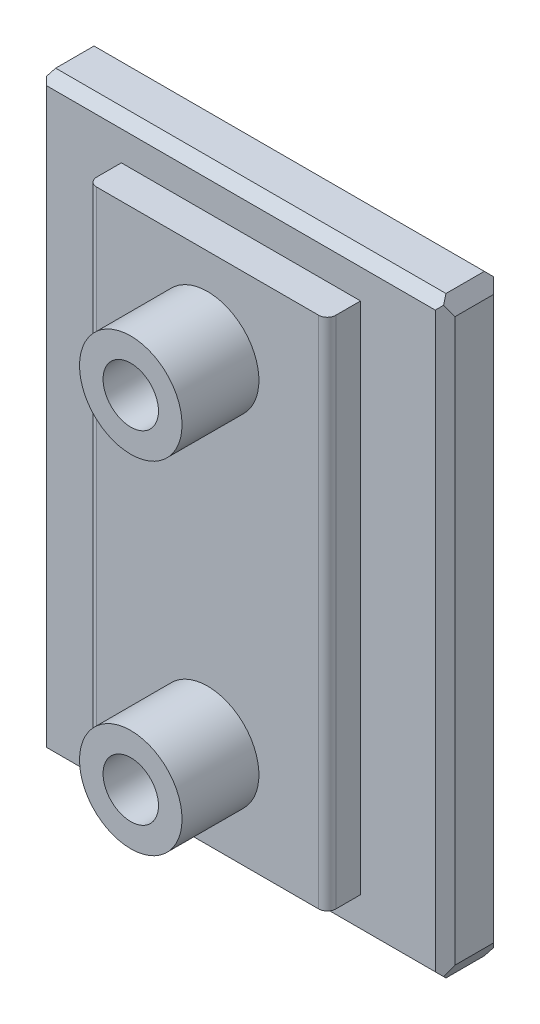
from build123d import *
from OCP.BRepFilletAPI import BRepFilletAPI_MakeChamfer

# Parameters (mm, degrees)
SKETCH1_W           = 23.9
SKETCH1_H           = 34.7
BOSS_EXTRUDE1_DEPTH = 3.4
SKETCH2_W           = 14
SKETCH2_H           = 30.1
BOSS_EXTRUDE2_DEPTH = 1.95
SKETCH3_R           = 3
BOSS_EXTRUDE3_DEPTH = 4.5
CHAMFER1_SIZE       = 0.577
CUT_EXTRUDE1_DEPTH  = 5.2
SKETCH6_W           = 14
SKETCH6_H           = 30
CUT_EXTRUDE2_DEPTH  = 0.6
SKETCH7_R           = 4.25
CUT_EXTRUDE3_DEPTH  = 2.3
SKETCH8_R           = 2.25
CUT_EXTRUDE4_DEPTH  = 1.5
FILLET1_R           = 0.5
CHAMFER2_SIZE       = 0.577
CHAMFER3_SIZE       = 0.527
CHAMFER3_SIZE2      = 0.913344887
CHAMFER4_SIZE       = 0.913344887
CHAMFER4_SIZE2      = 0.527
CUT_EXTRUDE5_REACH  = 25.256
SKETCH9_R           = 1.621
CHAMFER5_SIZE       = 0.2


with BuildPart() as part:
    # Sketch1 → Boss-Extrude1 (new body)
    with BuildSketch(Plane.XY):
        Rectangle(SKETCH1_W, SKETCH1_H)
    extrude(amount=-BOSS_EXTRUDE1_DEPTH)

    # Sketch2 → Boss-Extrude2 (add)
    with BuildSketch(Plane.XY):
        Rectangle(SKETCH2_W, SKETCH2_H)
    extrude(amount=BOSS_EXTRUDE2_DEPTH)

    # Sketch3 → Boss-Extrude3 (add)
    with BuildSketch(Plane.XY.offset(1.95)):
        with Locations(Location((0, 10, 0), (0, 0, 180))):
            Circle(SKETCH3_R)
        with Locations(Location((0, -10, 0), (0, 0, 180))):
            Circle(SKETCH3_R)
    extrude(amount=BOSS_EXTRUDE3_DEPTH)

    # Chamfer1
    chamfer1_edges = [part.edges().sort_by_distance(p)[0] for p in [
        (11.95, 0, -3.4),
        (0, 17.35, -3.4),
        (-11.95, 0, -3.4),
        (0, -17.35, -3.4),
    ]]
    chamfer(chamfer1_edges, length=CHAMFER1_SIZE)

    # Sketch5 → Cut-Extrude1 (cut, symmetric)
    with BuildSketch(Plane(origin=(0, 0, 0), x_dir=(0, 0, -1), z_dir=(1, 0, 0))):
        Polygon((3.4, 16.773), (2.823, 17.35), (2.823, 16.826999997), (2.449999998, 16.826999997), (2.449999998, -16.826999997), (2.823, -16.826999997), (2.823, -17.35), (3.4, -16.773), align=None)
    extrude(amount=CUT_EXTRUDE1_DEPTH, both=True, mode=Mode.SUBTRACT)

    # Sketch6 → Cut-Extrude2 (cut)
    with BuildSketch(Plane(origin=(0, 0, -2.449999998), x_dir=(-1, 0, 0), z_dir=(0, 0, -1))):
        Rectangle(SKETCH6_W, SKETCH6_H)
    extrude(amount=-CUT_EXTRUDE2_DEPTH, mode=Mode.SUBTRACT)

    # Sketch7 → Cut-Extrude3 (cut)
    with BuildSketch(Plane.XY.offset(-1.849999998)):
        with Locations(Location((0, 10, 0), (0, 0, 180))):
            Circle(SKETCH7_R)
        with Locations(Location((0, -10, 0), (0, 0, 180))):
            Circle(SKETCH7_R)
    extrude(amount=CUT_EXTRUDE3_DEPTH, mode=Mode.SUBTRACT)

    # Sketch8 → Cut-Extrude4 (cut)
    with BuildSketch(Plane.XY.offset(0.450000002)):
        with Locations(Location((0, 10, 0), (0, 0, 180))):
            Circle(SKETCH8_R)
        with Locations(Location((0, -10, 0), (0, 0, 180))):
            Circle(SKETCH8_R)
    extrude(amount=CUT_EXTRUDE4_DEPTH, mode=Mode.SUBTRACT)

    # Fillet1
    fillet1_edges = [part.edges().sort_by_distance(p)[0] for p in [
        (-7, 0, 1.95),
        (7, 0, 1.95),
    ]]
    fillet(fillet1_edges, radius=FILLET1_R)

    # Chamfer2
    chamfer2_edges = [part.edges().sort_by_distance(p)[0] for p in [
        (0, 17.35, 0),
        (11.95, 0, 0),
        (0, -17.35, 0),
        (-11.95, 0, 0),
    ]]
    chamfer(chamfer2_edges, length=CHAMFER2_SIZE)

    # Chamfer3: one chamfer whose edges measure the first distance from different faces: ONE call of the kernel's chamfer builder (chamfer() names one face for all edges)
    chamfer3_edges_1 = [part.edges().sort_by_distance(p)[0] for p in [
        (11.95, 17.35, -1.7),
    ]]
    chamfer3_side_1 = [part.faces().sort_by_distance(p)[0] for p in [
        (0, 17.35, -1.7),
    ]]
    chamfer3_edges_2 = [part.edges().sort_by_distance(p)[0] for p in [
        (-11.95, -17.35, -1.7),
    ]]
    chamfer3_side_2 = [part.faces().sort_by_distance(p)[0] for p in [
        (0, -17.35, -1.7),
    ]]
    chamfer3 = BRepFilletAPI_MakeChamfer(part.part.solid().wrapped)
    for e in chamfer3_edges_1:
        chamfer3.Add(CHAMFER3_SIZE, CHAMFER3_SIZE2, e.wrapped, chamfer3_side_1[0].wrapped)  # the first distance lies on this face
    for e in chamfer3_edges_2:
        chamfer3.Add(CHAMFER3_SIZE, CHAMFER3_SIZE2, e.wrapped, chamfer3_side_2[0].wrapped)  # the first distance lies on this face
    add(Compound.cast(chamfer3.Shape()), mode=Mode.REPLACE)

    # Chamfer4: one chamfer whose edges measure the first distance from different faces: ONE call of the kernel's chamfer builder (chamfer() names one face for all edges)
    chamfer4_edges_1 = [part.edges().sort_by_distance(p)[0] for p in [
        (-11.95, 17.35, -1.7),
    ]]
    chamfer4_side_1 = [part.faces().sort_by_distance(p)[0] for p in [
        (-11.95, 0.456672443, -1.7),
    ]]
    chamfer4_edges_2 = [part.edges().sort_by_distance(p)[0] for p in [
        (11.95, -17.35, -1.7),
    ]]
    chamfer4_side_2 = [part.faces().sort_by_distance(p)[0] for p in [
        (11.95, -0.456672443, -1.7),
    ]]
    chamfer4 = BRepFilletAPI_MakeChamfer(part.part.solid().wrapped)
    for e in chamfer4_edges_1:
        chamfer4.Add(CHAMFER4_SIZE, CHAMFER4_SIZE2, e.wrapped, chamfer4_side_1[0].wrapped)  # the first distance lies on this face
    for e in chamfer4_edges_2:
        chamfer4.Add(CHAMFER4_SIZE, CHAMFER4_SIZE2, e.wrapped, chamfer4_side_2[0].wrapped)  # the first distance lies on this face
    add(Compound.cast(chamfer4.Shape()), mode=Mode.REPLACE)

    # Sketch9 → Cut-Extrude5 (cut, up to next)
    with BuildSketch(Plane.XY.offset(6.45), mode=Mode.PRIVATE) as cut_extrude5_sk1:
        with Locations((0, 10)):
            Circle(SKETCH9_R)
    cut_extrude5_tool1 = extrude(cut_extrude5_sk1.sketch, amount=-CUT_EXTRUDE5_REACH, mode=Mode.PRIVATE) & part.part
    # Sketch9 → Cut-Extrude5 (cut, up to next)
    with BuildSketch(Plane.XY.offset(6.45), mode=Mode.PRIVATE) as cut_extrude5_sk2:
        with Locations((0, -10)):
            Circle(SKETCH9_R)
    cut_extrude5_tool2 = extrude(cut_extrude5_sk2.sketch, amount=-CUT_EXTRUDE5_REACH, mode=Mode.PRIVATE) & part.part
    add(cut_extrude5_tool1.solids().sort_by_distance((0, 10, 6.45))[0], mode=Mode.SUBTRACT)
    add(cut_extrude5_tool2.solids().sort_by_distance((0, -10, 6.45))[0], mode=Mode.SUBTRACT)

    # Chamfer5
    chamfer5_edges = [part.edges().sort_by_distance(p)[0] for p in [
        (2.25, -10, 0.450000002),
        (2.25, 10, 0.450000002),
    ]]
    chamfer(chamfer5_edges, length=CHAMFER5_SIZE)


solid = part.part
